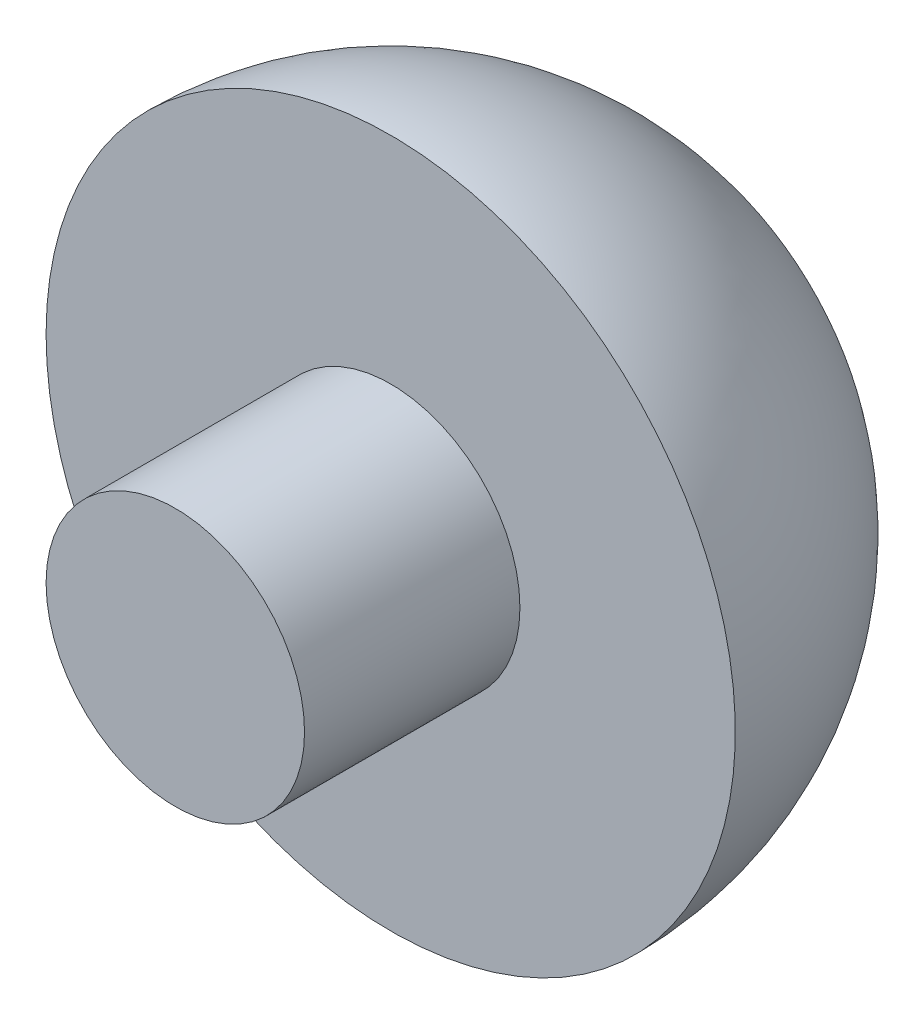
from build123d import *

# Parameters (mm, degrees)
REVOLVE1_ANGLE      = 180
SKETCH4_R           = 6
BOSS_EXTRUDE1_DEPTH = 10


with BuildPart() as part:
    # Sketch1 → Revolve1 (revolve)
    with BuildSketch(Plane.XY):
        with BuildLine():
            Line((0, -16), (0, 16))
            ThreePointArc((0, 16), (16, 0), (0, -16))
        make_face()
    revolve(axis=Axis((0, -16, 0), (0, 1, 0)), revolution_arc=REVOLVE1_ANGLE)

    # Sketch4 → Boss-Extrude1 (add)
    with BuildSketch(Plane.XY):
        with Locations(Location((0, 0, 0), (0, 0, 180))):
            Circle(SKETCH4_R)
    extrude(amount=BOSS_EXTRUDE1_DEPTH)


solid = part.part
